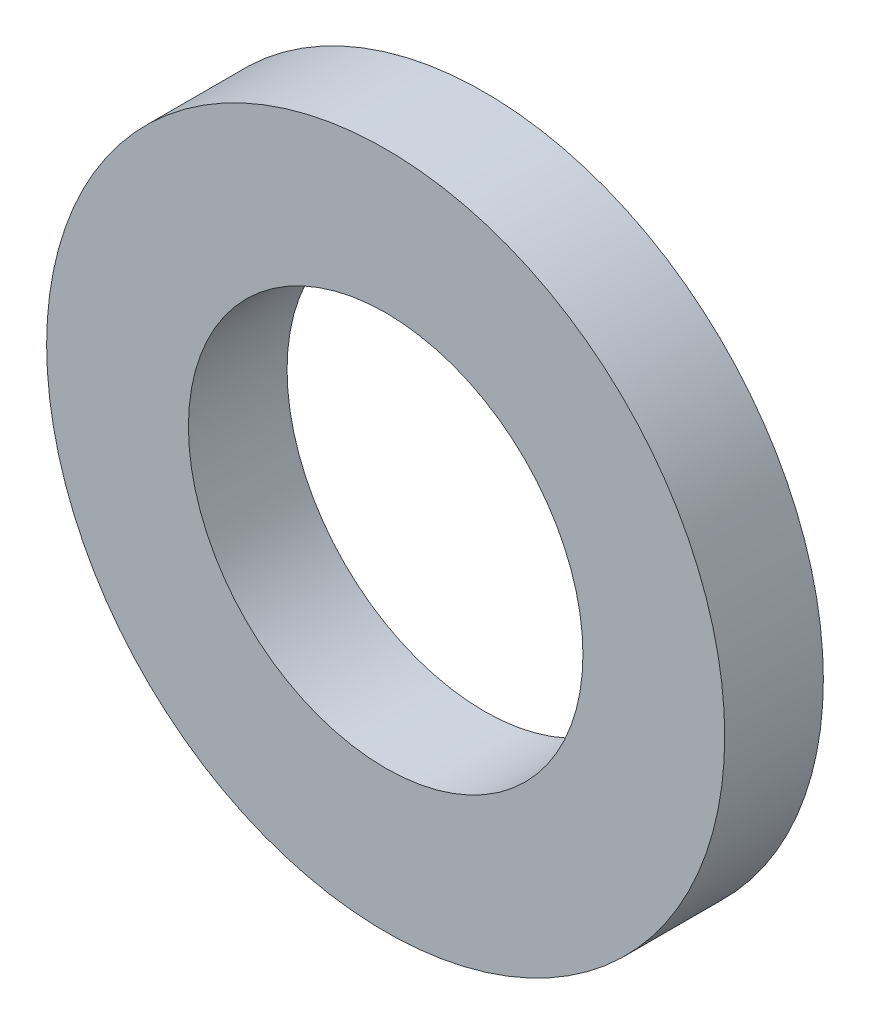
from build123d import *

# Parameters (mm, degrees)
SKETCH_1_R          = 5.49999997
EXTRUDE_1_DEPTH     = 1.600000076
SKETCH_2_R          = 3.200000152
CUT_EXTRUDE_1_DEPTH = 8.941032652


with BuildPart() as part:
    # 草图1 → 拉伸1 (new body)
    with BuildSketch(Plane.XY):
        with Locations(Location((0, 0, 0), (0, 0, 180))):
            Circle(SKETCH_1_R)
    extrude(amount=EXTRUDE_1_DEPTH)

    # 草图2 → 切除-拉伸1 (cut, through all)
    with BuildSketch(Plane.XY.offset(1.600000076)):
        Circle(SKETCH_2_R)
    extrude(amount=-CUT_EXTRUDE_1_DEPTH, mode=Mode.SUBTRACT)


solid = part.part
